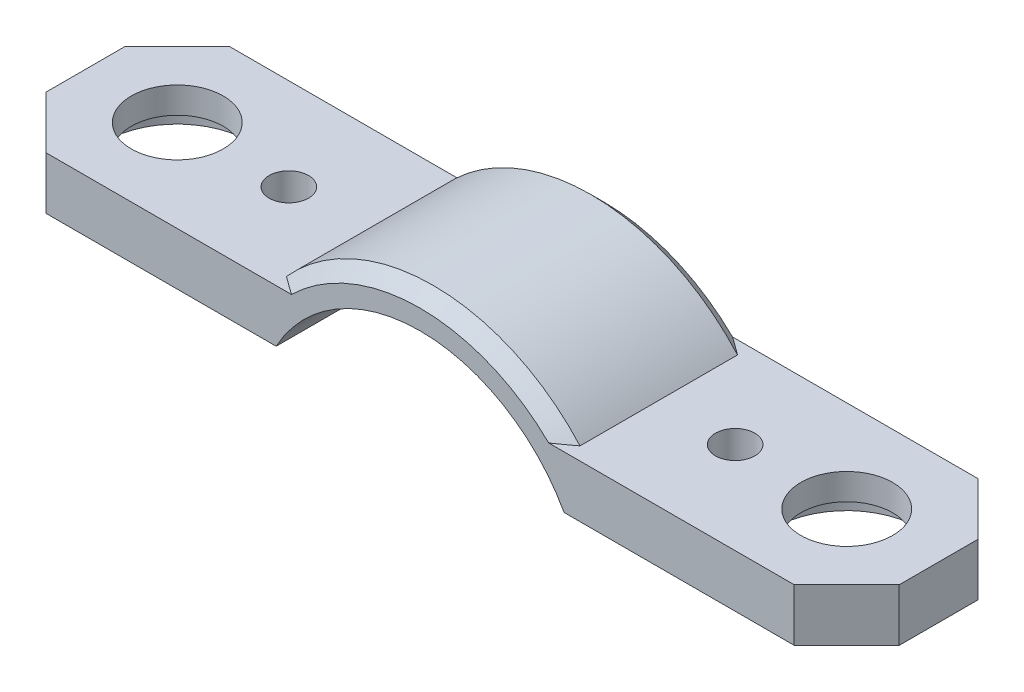
from build123d import *

# Parameters (mm, degrees)
ESQUISSE2_W             = 65
ESQUISSE2_H             = 14
BOSS_EXTRU_1_DEPTH      = 4
ESQUISSE3_R             = 5.5
ENL_V_MAT_EXTRU_1_DEPTH = 2
ESQUISSE4_R             = 3.5
ENL_V_MAT_EXTRU_2_DEPTH = 38.080787511
BOSS_EXTRU_3_DEPTH      = 14
ESQUISSE7_R             = 12.5
ENL_V_MAT_EXTRU_4_DEPTH = 39.788005272
ESQUISSE8_R             = 1.5
ENL_V_MAT_EXTRU_5_DEPTH = 38.362880007
CHANFREIN1_SIZE         = 1
CHANFREIN2_SIZE         = 4


with BuildPart() as part:
    # Esquisse2 → Boss.-Extru.1 (new body)
    with BuildSketch(Plane(origin=(0, 0, 0), x_dir=(1, 0, 0), z_dir=(0, 1, 0))):
        with Locations((-3.326098768, -2.352831094)):
            Rectangle(ESQUISSE2_W, ESQUISSE2_H)
    extrude(amount=-BOSS_EXTRU_1_DEPTH)

    # Esquisse3 → Enlèv. mat.-Extru.1 (cut)
    with BuildSketch(Plane.XZ.offset(4)):
        with Locations(Location((-28.826098768, 2.352831094, 0), (0, 0, 270))):
            Circle(ESQUISSE3_R)
        with Locations(Location((22.173901232, 2.352831094, 0), (0, 0, 270))):
            Circle(ESQUISSE3_R)
    extrude(amount=-ENL_V_MAT_EXTRU_1_DEPTH, mode=Mode.SUBTRACT)

    # Esquisse4 → Enlèv. mat.-Extru.2 (cut, through all)
    with BuildSketch(Plane.XZ.offset(2)):
        with Locations(Location((-28.826098768, 2.352831094, 0), (0, 0, 270))):
            Circle(ESQUISSE4_R)
        with Locations(Location((22.173901232, 2.352831094, 0), (0, 0, 270))):
            Circle(ESQUISSE4_R)
    extrude(amount=-ENL_V_MAT_EXTRU_2_DEPTH, mode=Mode.SUBTRACT)

    # Esquisse5 → Boss.-Extru.3 (add)
    with BuildSketch(Plane(origin=(0, 0, -4.647168906), x_dir=(-1, 0, 0), z_dir=(0, 0, -1))):
        with BuildLine():
            Line((-10.421628317, -4), (17.073825853, -4))
            ThreePointArc((17.073825853, -4), (3.326098768, 5), (-10.421628317, -4))
        make_face()
    extrude(amount=-BOSS_EXTRU_3_DEPTH)

    # Esquisse7 → Enlèv. mat.-Extru.4 (cut, through all)
    with BuildSketch(Plane(origin=(0, 0, -4.647168906), x_dir=(-1, 0, 0), z_dir=(0, 0, -1))):
        with Locations((3.326098768, -10)):
            Circle(ESQUISSE7_R)
    extrude(amount=-ENL_V_MAT_EXTRU_4_DEPTH, mode=Mode.SUBTRACT)

    # Esquisse8 → Enlèv. mat.-Extru.5 (cut, through all)
    with BuildSketch(Plane(origin=(0, 0, 0), x_dir=(1, 0, 0), z_dir=(0, 1, 0))):
        with Locations(Location((-20.326098768, -2.352831094, 0), (0, 0, 270))):
            Circle(ESQUISSE8_R)
        with Locations(Location((13.673901232, -2.352831094, 0), (0, 0, 270))):
            Circle(ESQUISSE8_R)
    extrude(amount=-ENL_V_MAT_EXTRU_5_DEPTH, mode=Mode.SUBTRACT)

    # Chanfrein1
    chanfrein1_edges = [part.edges().sort_by_distance(p)[0] for p in [
        (-3.326098768, 5, 9.352831094),
        (-3.326098768, 5, -4.647168906),
    ]]
    chamfer(chanfrein1_edges, length=CHANFREIN1_SIZE)

    # Chanfrein2
    chanfrein2_edges = [part.edges().sort_by_distance(p)[0] for p in [
        (-35.826098768, -2, -4.647168906),
        (29.173901232, -2, -4.647168906),
        (29.173901232, -2, 9.352831094),
        (-35.826098768, -2, 9.352831094),
    ]]
    chamfer(chanfrein2_edges, length=CHANFREIN2_SIZE)


solid = part.part
